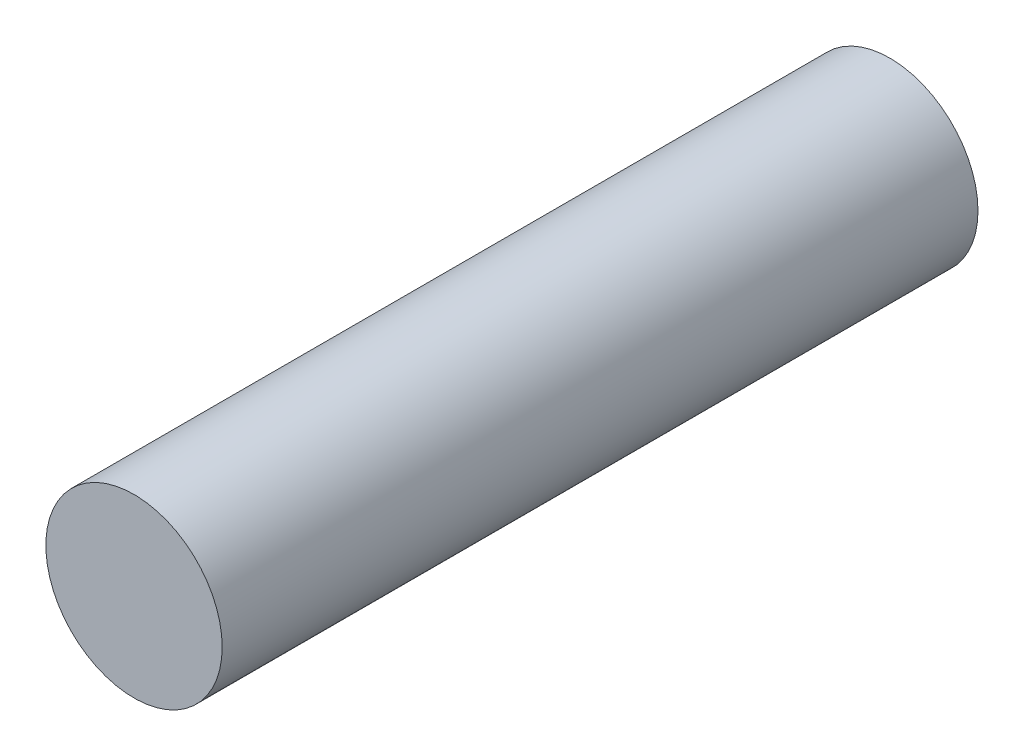
from build123d import *

# Parameters (mm, degrees)
SKETCH_1_R      = 0.7
EXTRUDE_1_DEPTH = 6


with BuildPart() as part:
    # 草图1 → 凸台-拉伸1 (new body)
    with BuildSketch(Plane.XY):
        Circle(SKETCH_1_R)
    extrude(amount=EXTRUDE_1_DEPTH)


solid = part.part
